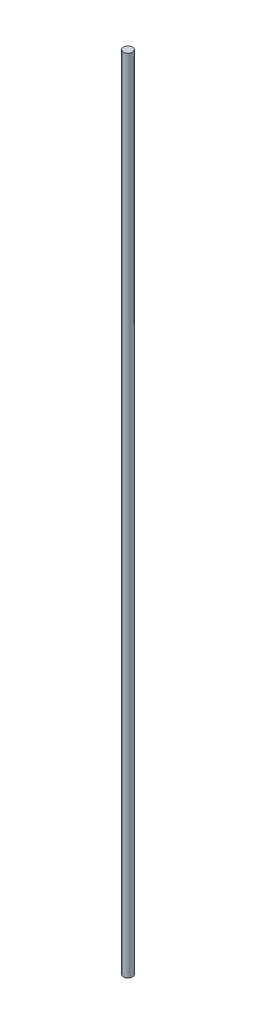
from build123d import *

# Parameters (mm, degrees)
SKETCH1_R           = 3.1
BOSS_EXTRUDE1_DEPTH = 556


with BuildPart() as part:
    # Sketch1 → Boss-Extrude1 (new body)
    with BuildSketch(Plane(origin=(0, 0, 0), x_dir=(-1, 0, 0), z_dir=(0, 1, 0))):
        with Locations(Location((0, 0, 0), (0, 0, 90))):
            Circle(SKETCH1_R)
    extrude(amount=BOSS_EXTRUDE1_DEPTH)


solid = part.part
